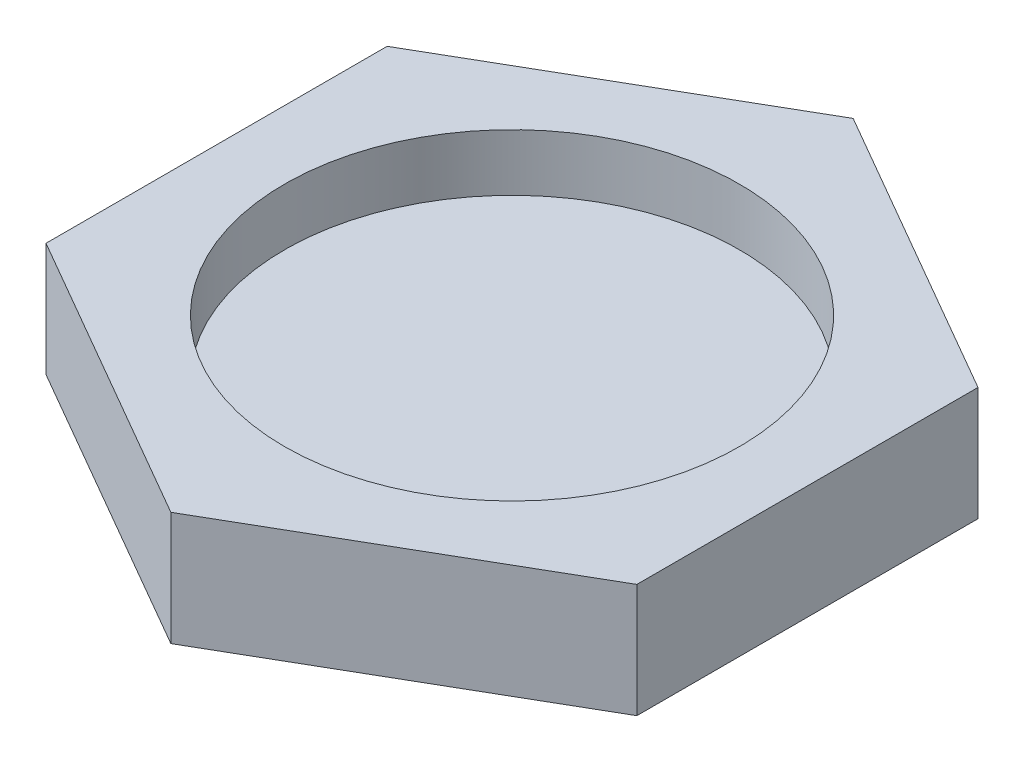
from build123d import *

# Parameters (mm, degrees)
BOSS_EXTRUDE1_DEPTH = 50.8
SKETCH2_R           = 101.6
CUT_EXTRUDE1_DEPTH  = 25.4


with BuildPart() as part:
    # Sketch1 → Boss-Extrude1 (new body)
    with BuildSketch(Plane(origin=(0, 0, 0), x_dir=(1, 0, 0), z_dir=(0, 1, 0))):
        Polygon((0, 152.4), (-131.982271537, 76.2), (-131.982271537, -76.2), (0, -152.4), (131.982271537, -76.2), (131.982271537, 76.2), align=None)
    extrude(amount=BOSS_EXTRUDE1_DEPTH)

    # Sketch2 → Cut-Extrude1 (cut)
    with BuildSketch(Plane(origin=(0, 50.8, 0), x_dir=(1, 0, 0), z_dir=(0, 1, 0))):
        with Locations(Location((0, 0, 0), (0, 0, 270))):
            Circle(SKETCH2_R)
    extrude(amount=-CUT_EXTRUDE1_DEPTH, mode=Mode.SUBTRACT)


solid = part.part
